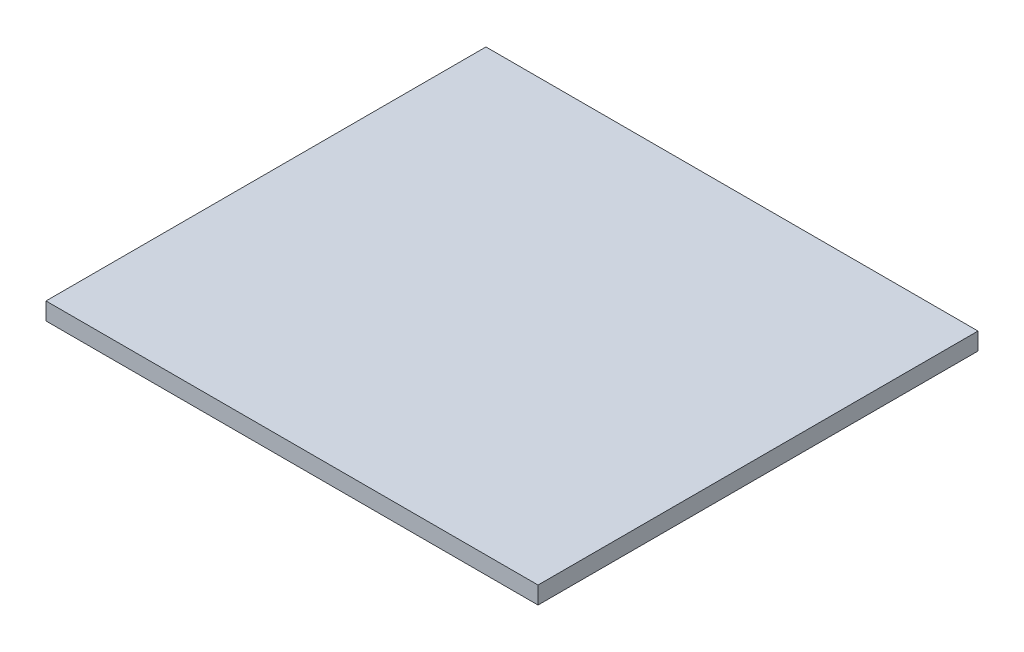
from build123d import *

# Parameters (mm, degrees)
SKETCH1_W           = 85
SKETCH1_H           = 76
BOSS_EXTRUDE1_DEPTH = 3


with BuildPart() as part:
    # Sketch1 → Boss-Extrude1 (new body)
    with BuildSketch(Plane(origin=(0, 0, 0), x_dir=(1, 0, 0), z_dir=(0, 1, 0))):
        Rectangle(SKETCH1_W, SKETCH1_H)
    extrude(amount=BOSS_EXTRUDE1_DEPTH)


solid = part.part
